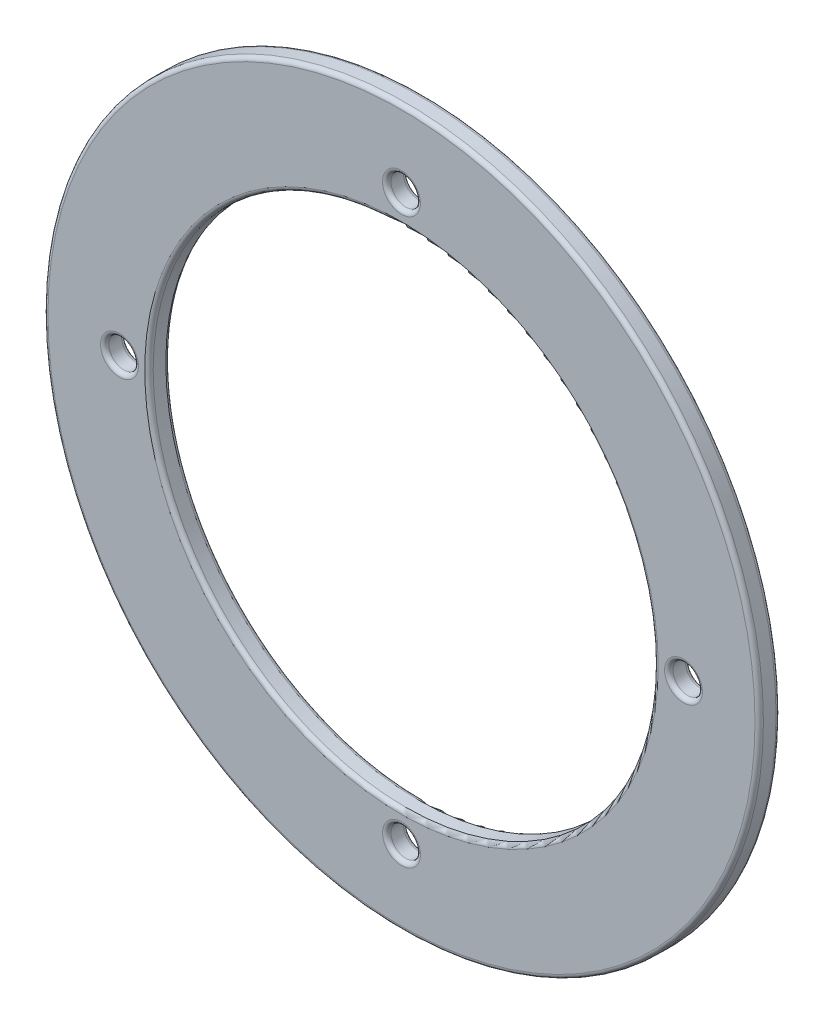
from build123d import *

# Parameters (mm, degrees)
SKETCH1_R               = 42.5
SKETCH1_R_2             = 2.25
SKETCH1_R_3             = 1.75
BOSS_EXTRUDE1_DEPTH     = 2.5
SKETCH2_R               = 29.85
SKETCH2_R_2             = 12.65
BOSS_EXTRUDE2_DEPTH     = 1
CUT_EXTRUDE1_DEPTH      = 61.156047078
CUT_EXTRUDE1_DEPTH_BACK = 61.156047078
SKETCH3_R               = 30
FILLET1_R               = 0.5


with BuildPart() as part:
    # Sketch1 → Boss-Extrude1 (new body)
    with BuildSketch(Plane.XY):
        Circle(SKETCH1_R)
        Circle(SKETCH1_R_2, mode=Mode.SUBTRACT)
        with Locations((0, 33.5)):
            Circle(SKETCH1_R_3, mode=Mode.SUBTRACT)
        with Locations((33.5, 0)):
            Circle(SKETCH1_R_3, mode=Mode.SUBTRACT)
        with Locations((0, -33.5)):
            Circle(SKETCH1_R_3, mode=Mode.SUBTRACT)
        with Locations((-33.5, 0)):
            Circle(SKETCH1_R_3, mode=Mode.SUBTRACT)
    extrude(amount=BOSS_EXTRUDE1_DEPTH)

    # Sketch2 → Boss-Extrude2 (add)
    with BuildSketch(Plane(origin=(0, 0, 0), x_dir=(-1, 0, 0), z_dir=(0, 0, -1))):
        Circle(SKETCH2_R)
        Circle(SKETCH2_R_2, mode=Mode.SUBTRACT)
    extrude(amount=BOSS_EXTRUDE2_DEPTH)

    # Sketch3 → Cut-Extrude1 (cut, two sides: drawn at the far end of the back side and taken through both)
    with BuildSketch(Plane.XY.offset(-CUT_EXTRUDE1_DEPTH_BACK)):
        Circle(SKETCH3_R)
    extrude(amount=CUT_EXTRUDE1_DEPTH + CUT_EXTRUDE1_DEPTH_BACK, mode=Mode.SUBTRACT)

    # Fillet1
    fillet1_edges = [part.edges().sort_by_distance(p)[0] for p in [
        (31.75, 0, 0),
        (31.75, 0, 2.5),
        (-1.75, -33.5, 0),
        (-1.75, -33.5, 2.5),
        (-42.5, 0, 0),
        (-35.25, 0, 0),
        (-35.25, 0, 2.5),
        (-30, 0, 0),
        (-30, 0, 2.5),
        (-42.5, 0, 2.5),
        (-1.75, 33.5, 0),
        (-1.75, 33.5, 2.5),
    ]]
    fillet(fillet1_edges, radius=FILLET1_R)


solid = part.part
